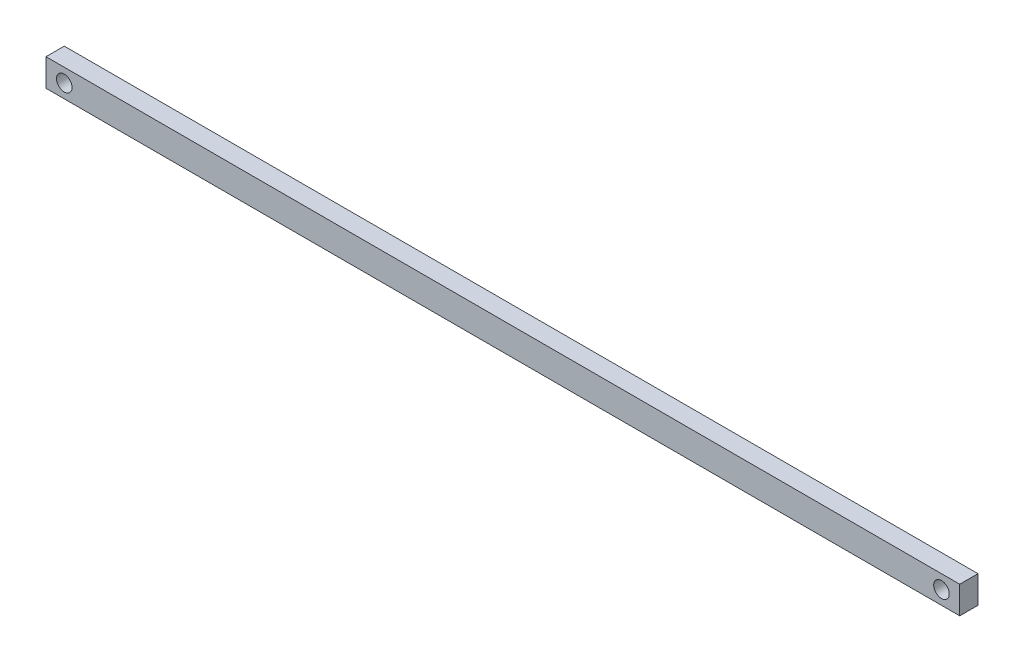
from build123d import *

# Parameters (mm, degrees)
SKETCH1_W           = 500
SKETCH1_H           = 15
BOSS_EXTRUDE1_DEPTH = 10
SKETCH2_R           = 4.255
CUT_EXTRUDE1_DEPTH  = 10


with BuildPart() as part:
    # Sketch1 → Boss-Extrude1 (new body)
    with BuildSketch(Plane.XY):
        with Locations((250, 7.5)):
            Rectangle(SKETCH1_W, SKETCH1_H)
    extrude(amount=BOSS_EXTRUDE1_DEPTH)

    # Sketch2 → Cut-Extrude1 (cut)
    with BuildSketch(Plane.XY.offset(10)):
        with Locations((10, 7.5)):
            Circle(SKETCH2_R)
        with Locations((490, 7.5)):
            Circle(SKETCH2_R)
    extrude(amount=-CUT_EXTRUDE1_DEPTH, mode=Mode.SUBTRACT)


solid = part.part
